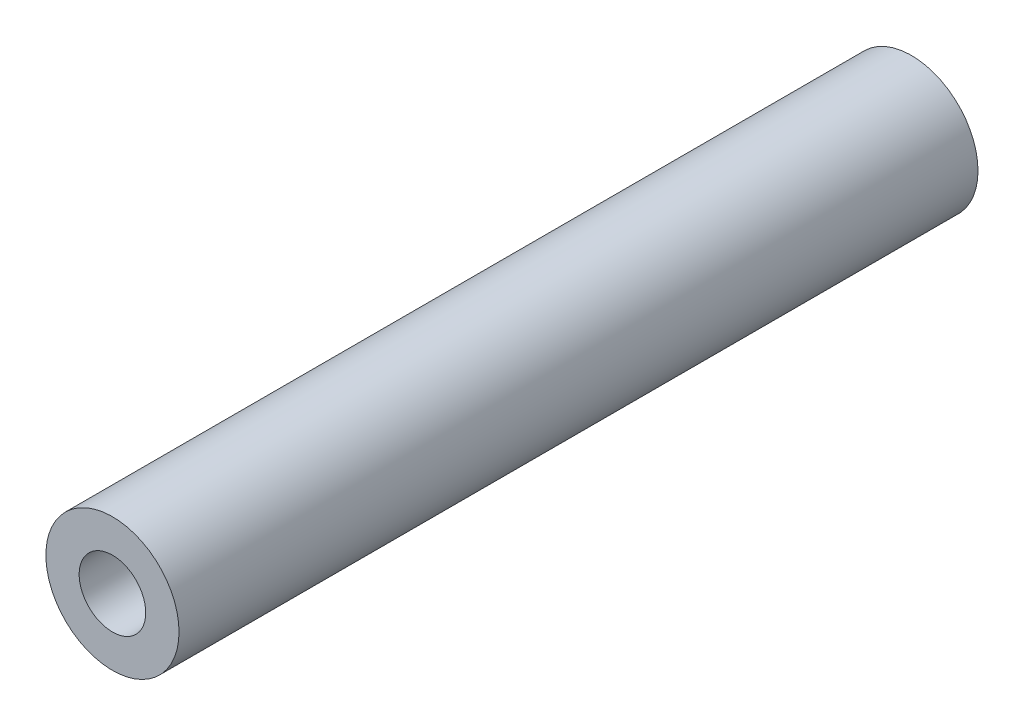
from build123d import *

# Parameters (mm, degrees)
SKETCH2_R           = 10
SKETCH2_R_2         = 5
BOSS_EXTRUDE1_DEPTH = 120


with BuildPart() as part:
    # Sketch2 → Boss-Extrude1 (new body)
    with BuildSketch(Plane(origin=(0, 0, 0), x_dir=(0, 1, 0), z_dir=(0, 0, 1))):
        with Locations(Location((0, 0, 0), (0, 0, 270))):
            Circle(SKETCH2_R)
        with Locations(Location((0, 0, 0), (0, 0, 270))):
            Circle(SKETCH2_R_2, mode=Mode.SUBTRACT)
    extrude(amount=BOSS_EXTRUDE1_DEPTH)


solid = part.part
